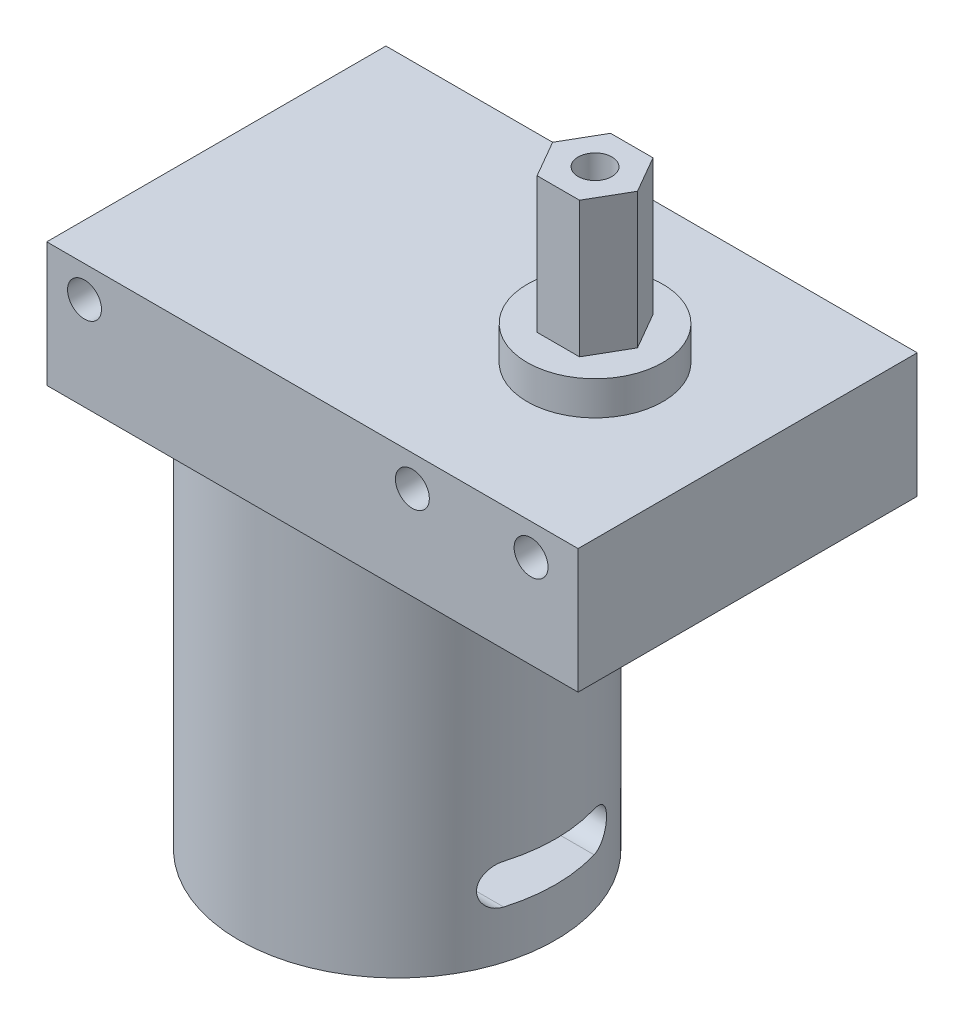
from build123d import *

# Parameters (mm, degrees)
SKETCH_1_W          = 47
SKETCH_1_H          = 30
EXTRUDE_1_DEPTH     = 11
SKETCH_2_R          = 6
EXTRUDE_2_DEPTH     = 3
EXTRUDE_3_DEPTH     = 12
SKETCH_4_R          = 14
EXTRUDE_4_DEPTH     = 35
SKETCH_5_R          = 5
EXTRUDE_5_DEPTH     = 2
SKETCH_6_R          = 1.5
CUT_EXTRUDE_1_DEPTH = 67.917860097
CUT_EXTRUDE_2_DEPTH = 67.917860097
SKETCH_9_R          = 1.5
CUT_EXTRUDE_3_DEPTH = 8


with BuildPart() as part:
    # 草图1 → 凸台-拉伸1 (new body)
    with BuildSketch(Plane(origin=(0, 0, 0), x_dir=(1, 0, 0), z_dir=(0, 1, 0))):
        with Locations((23.5, -15)):
            Rectangle(SKETCH_1_W, SKETCH_1_H)
    extrude(amount=EXTRUDE_1_DEPTH)

    # 草图2 → 凸台-拉伸2 (add)
    with BuildSketch(Plane(origin=(0, 11, 0), x_dir=(1, 0, 0), z_dir=(0, 1, 0))):
        with Locations(Location((33.5, -15, 0), (0, 0, 270))):
            Circle(SKETCH_2_R)
    extrude(amount=EXTRUDE_2_DEPTH)

    # 草图3 → 凸台-拉伸3 (add)
    with BuildSketch(Plane(origin=(0, 14, 0), x_dir=(1, 0, 0), z_dir=(0, 1, 0))):
        Polygon((37.25277675, -15), (35.376388375, -11.75), (31.623611625, -11.75), (29.74722325, -15), (31.623611625, -18.25), (35.376388375, -18.25), align=None)
    extrude(amount=EXTRUDE_3_DEPTH)

    # 草图4 → 凸台-拉伸4 (add)
    with BuildSketch(Plane.XZ):
        with Locations(Location((16, 15, 0), (0, 0, 90))):
            Circle(SKETCH_4_R)
    extrude(amount=EXTRUDE_4_DEPTH)

    # 草图5 → 凸台-拉伸5 (add)
    with BuildSketch(Plane.XZ.offset(35)):
        with Locations(Location((16, 15, 0), (0, 0, 270))):
            Circle(SKETCH_5_R)
    extrude(amount=EXTRUDE_5_DEPTH)

    # 草图6 → 切除-拉伸1 (cut, through all)
    with BuildSketch(Plane.XY.offset(30)):
        with Locations((3.340757383, 8.25)):
            Circle(SKETCH_6_R)
        with Locations((32.340757383, 8.25)):
            Circle(SKETCH_6_R)
        with Locations((42.840757383, 8.25)):
            Circle(SKETCH_6_R)
    extrude(amount=-CUT_EXTRUDE_1_DEPTH, mode=Mode.SUBTRACT)

    # 草图7 → 切除-拉伸2 (cut, through all)
    with BuildSketch(Plane.ZY):
        with BuildLine():
            Line((11, -27.25), (19, -27.25))
            ThreePointArc((19, -27.25), (20.75, -29), (19, -30.75))
            Line((19, -30.75), (11, -30.75))
            ThreePointArc((11, -30.75), (9.25, -29), (11, -27.25))
        make_face()
    extrude(amount=-CUT_EXTRUDE_2_DEPTH, mode=Mode.SUBTRACT)

    # 草图9 → 切除-拉伸3 (cut)
    with BuildSketch(Plane(origin=(0, 26, 0), x_dir=(1, 0, 0), z_dir=(0, 1, 0))):
        with Locations(Location((33.5, -15, 0), (0, 0, 270))):
            Circle(SKETCH_9_R)
    extrude(amount=-CUT_EXTRUDE_3_DEPTH, mode=Mode.SUBTRACT)


solid = part.part
